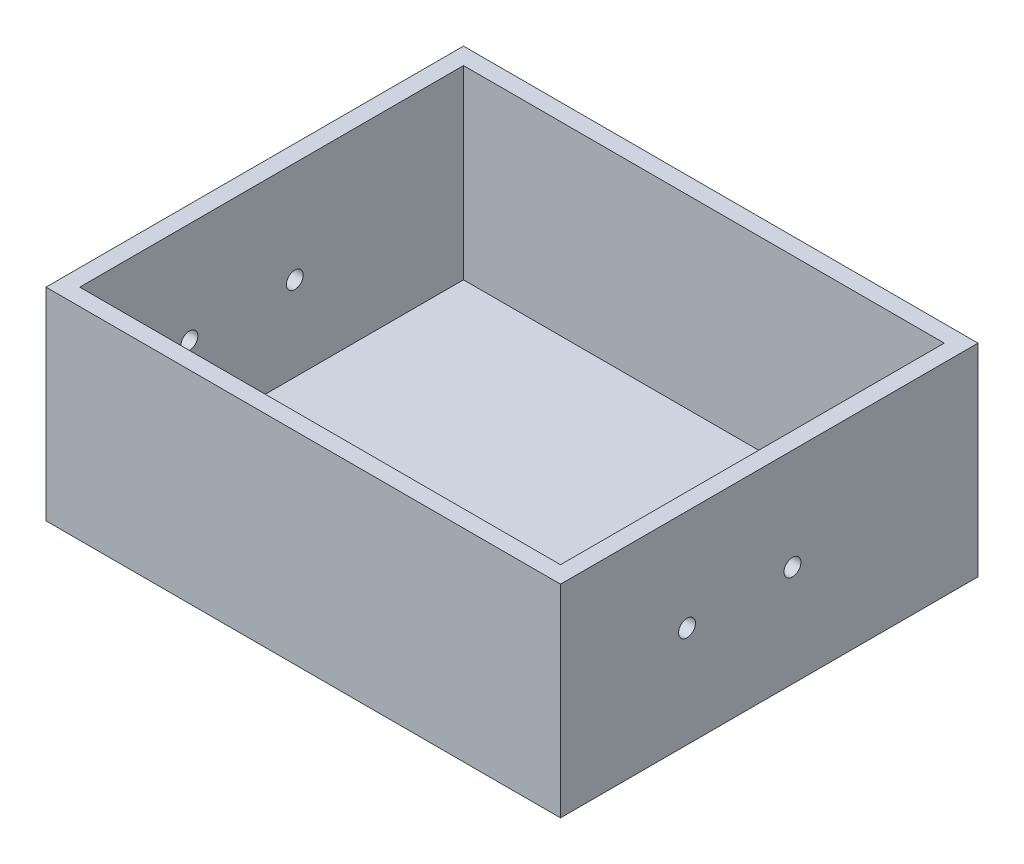
from build123d import *

# Parameters (mm, degrees)
SKETCH1_W           = 122
SKETCH1_H           = 99
BOSS_EXTRUDE1_DEPTH = 48
SKETCH2_W           = 114
SKETCH2_H           = 91
CUT_EXTRUDE1_DEPTH  = 44
SKETCH3_R           = 2
CUT_EXTRUDE2_DEPTH  = 141.13654056


with BuildPart() as part:
    # Sketch1 → Boss-Extrude1 (new body)
    with BuildSketch(Plane(origin=(0, 0, 0), x_dir=(1, 0, 0), z_dir=(0, 1, 0))):
        Rectangle(SKETCH1_W, SKETCH1_H)
    extrude(amount=BOSS_EXTRUDE1_DEPTH)

    # Sketch2 → Cut-Extrude1 (cut)
    with BuildSketch(Plane(origin=(0, 48, 0), x_dir=(1, 0, 0), z_dir=(0, 1, 0))):
        Rectangle(SKETCH2_W, SKETCH2_H)
    extrude(amount=-CUT_EXTRUDE1_DEPTH, mode=Mode.SUBTRACT)

    # Sketch3 → Cut-Extrude2 (cut, through all)
    with BuildSketch(Plane(origin=(61, 0, 0), x_dir=(0, 0, -1), z_dir=(1, 0, 0))):
        with Locations((-19.5, 24)):
            Circle(SKETCH3_R)
        with Locations((5.5, 24)):
            Circle(SKETCH3_R)
    extrude(amount=-CUT_EXTRUDE2_DEPTH, mode=Mode.SUBTRACT)


solid = part.part
